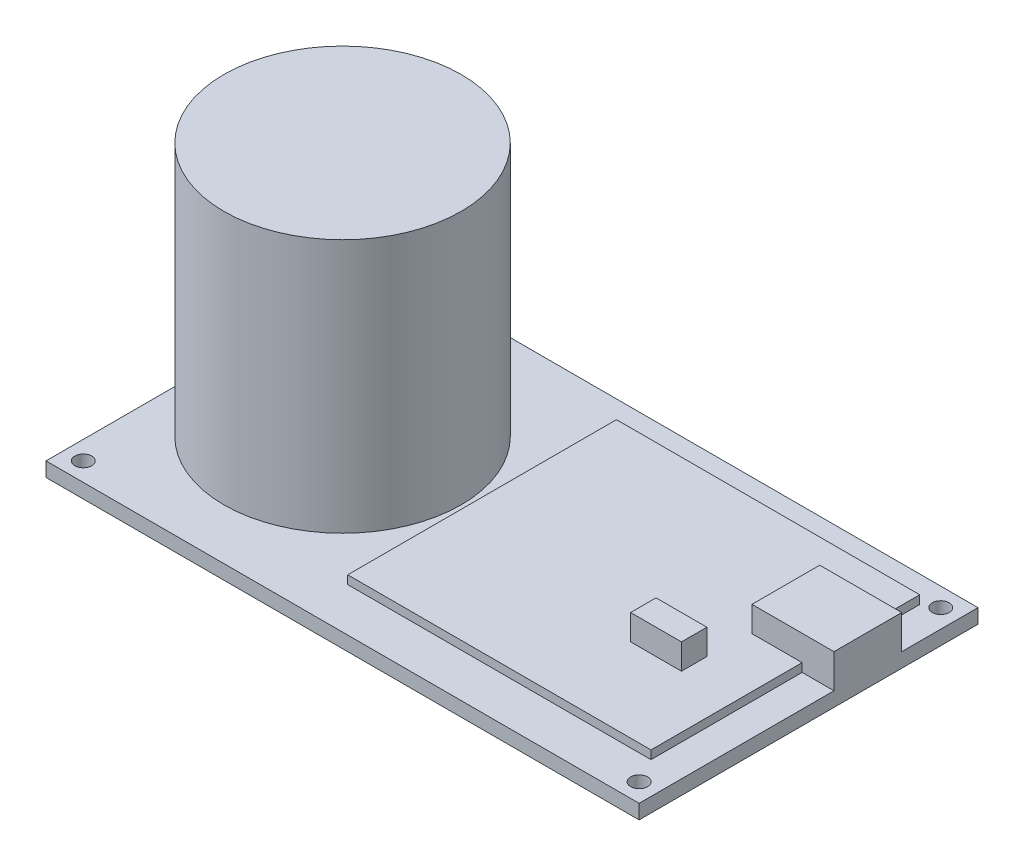
from build123d import *

# Parameters (mm, degrees)
SKETCH1_W           = 70
SKETCH1_H           = 40
BOSS_EXTRUDE1_DEPTH = 1.7
SKETCH2_R           = 1
CUT_EXTRUDE1_DEPTH  = 1.7
SKETCH3_R           = 14
BOSS_EXTRUDE2_DEPTH = 30
SKETCH4_W           = 9.678505403
SKETCH4_H           = 8
BOSS_EXTRUDE3_DEPTH = 4
SKETCH5_W           = 6
SKETCH5_H           = 3
BOSS_EXTRUDE4_DEPTH = 4
SKETCH6_W           = 62
SKETCH6_H           = 32
BOSS_EXTRUDE5_DEPTH = 1
SKETCH7_W           = 35.794081109
SKETCH7_H           = 31.717706103
BOSS_EXTRUDE6_DEPTH = 1


with BuildPart() as part:
    # Sketch1 → Boss-Extrude1 (new body)
    with BuildSketch(Plane(origin=(0, 0, 0), x_dir=(1, 0, 0), z_dir=(0, 1, 0))):
        with Locations((35, 20)):
            Rectangle(SKETCH1_W, SKETCH1_H)
    extrude(amount=BOSS_EXTRUDE1_DEPTH)

    # Sketch2 → Cut-Extrude1 (cut)
    with BuildSketch(Plane(origin=(0, 1.7, 0), x_dir=(1, 0, 0), z_dir=(0, 1, 0))):
        with Locations(Location((67.8, 37.8, 0), (0, 0, 270))):
            Circle(SKETCH2_R)
        with Locations(Location((2.2, 37.8, 0), (0, 0, 270))):
            Circle(SKETCH2_R)
        with Locations(Location((2.2, 2.2, 0), (0, 0, 270))):
            Circle(SKETCH2_R)
        with Locations(Location((67.8, 2.2, 0), (0, 0, 270))):
            Circle(SKETCH2_R)
    extrude(amount=-CUT_EXTRUDE1_DEPTH, mode=Mode.SUBTRACT)

    # Sketch3 → Boss-Extrude2 (add)
    with BuildSketch(Plane(origin=(0, 1.7, 0), x_dir=(1, 0, 0), z_dir=(0, 1, 0))):
        with Locations(Location((15, 20, 0), (0, 0, 90))):
            Circle(SKETCH3_R)
    extrude(amount=BOSS_EXTRUDE2_DEPTH)

    # Sketch4 → Boss-Extrude3 (add)
    with BuildSketch(Plane(origin=(0, 1.7, 0), x_dir=(1, 0, 0), z_dir=(0, 1, 0))):
        with Locations((65.160747298, 27)):
            Rectangle(SKETCH4_W, SKETCH4_H)
    extrude(amount=BOSS_EXTRUDE3_DEPTH)

    # Sketch5 → Boss-Extrude4 (add)
    with BuildSketch(Plane(origin=(0, 1.7, 0), x_dir=(1, 0, 0), z_dir=(0, 1, 0))):
        with Locations((57, 16.5)):
            Rectangle(SKETCH5_W, SKETCH5_H)
    extrude(amount=BOSS_EXTRUDE4_DEPTH)

    # Sketch6 → Boss-Extrude5 (add)
    with BuildSketch(Plane.XZ):
        with Locations((35, -20)):
            Rectangle(SKETCH6_W, SKETCH6_H)
    extrude(amount=BOSS_EXTRUDE5_DEPTH)

    # Sketch7 → Boss-Extrude6 (add)
    with BuildSketch(Plane(origin=(0, 1.7, 0), x_dir=(1, 0, 0), z_dir=(0, 1, 0))):
        with Locations((48.346916126, 21.020495195)):
            Rectangle(SKETCH7_W, SKETCH7_H)
    extrude(amount=BOSS_EXTRUDE6_DEPTH)


solid = part.part
